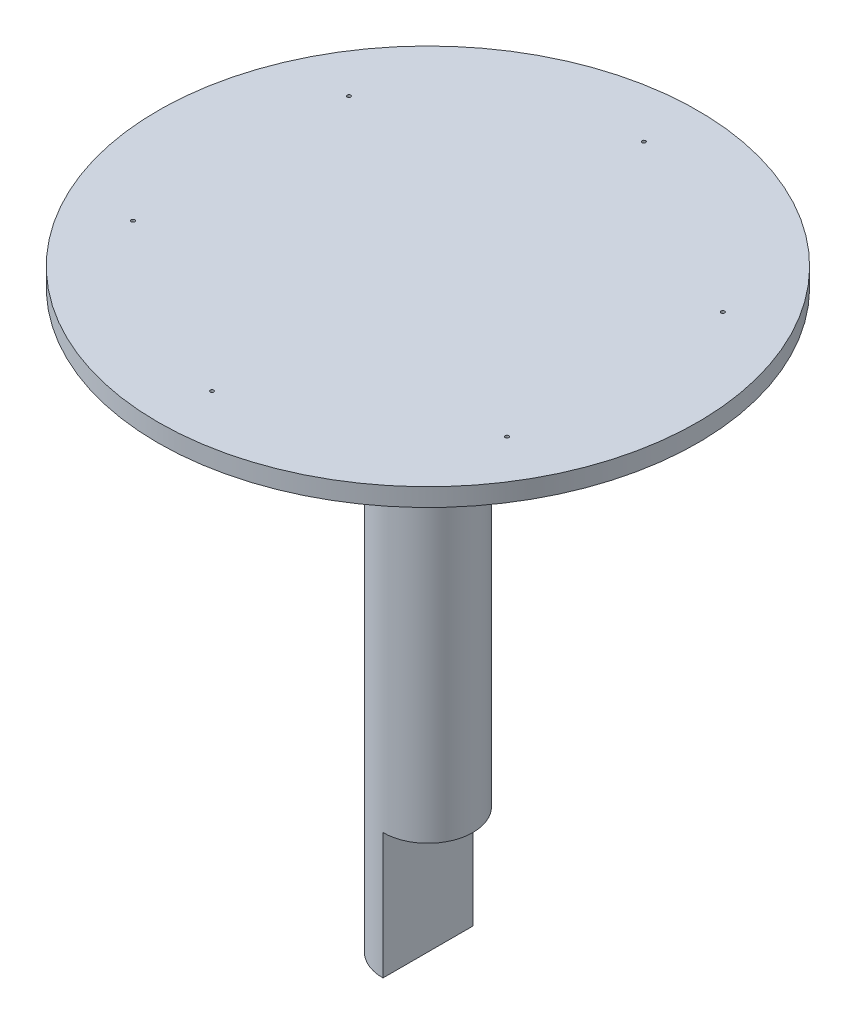
from build123d import *

# Parameters (mm, degrees)
BOSS_EXTRU_1_DEPTH      = 320
ENL_V_MAT_EXTRU_1_DEPTH = 70
ESQUISSE3_R             = 150
BOSS_EXTRU_2_DEPTH      = 10
ESQUISSE4_R             = 1
ENL_V_MAT_EXTRU_2_DEPTH = 10


with BuildPart() as part:
    # Esquisse1 → Boss.-Extru.1 (new body)
    with BuildSketch(Plane(origin=(0, 0, 0), x_dir=(1, 0, 0), z_dir=(0, 1, 0))):
        with BuildLine():
            ThreePointArc((56.049273334, -8.002390035), (31.049273334, 16.997609965), (6.049273334, -8.002390035))
            Line((6.049273334, -8.002390035), (56.049273334, -8.002390035))
        make_face()
        with BuildLine():
            Line((56.049273334, -8.002390035), (6.049273334, -8.002390035))
            ThreePointArc((6.049273334, -8.002390035), (31.049273334, -33.002390035), (56.049273334, -8.002390035))
        make_face()
    extrude(amount=BOSS_EXTRU_1_DEPTH)

    # Esquisse2 → Enlèv. mat.-Extru.1 (cut)
    with BuildSketch(Plane(origin=(0, 0, 0), x_dir=(-1, 0, 0), z_dir=(0, -1, 0))):
        with BuildLine():
            Line((-31.049273334, -33.002390035), (-31.049273334, 16.997609965))
            ThreePointArc((-31.049273334, 16.997609965), (-56.049273334, -8.002390035), (-31.049273334, -33.002390035))
        make_face()
    extrude(amount=-ENL_V_MAT_EXTRU_1_DEPTH, mode=Mode.SUBTRACT)

    # Esquisse3 → Boss.-Extru.2 (add)
    with BuildSketch(Plane(origin=(0, 320, 0), x_dir=(1, 0, 0), z_dir=(0, 1, 0))):
        with Locations(Location((31.049273334, -8.002390035, 0), (0, 0, 270))):
            Circle(ESQUISSE3_R)
    extrude(amount=BOSS_EXTRU_2_DEPTH)

    # Esquisse4 → Enlèv. mat.-Extru.2 (cut)
    with BuildSketch(Plane(origin=(0, 330, 0), x_dir=(1, 0, 0), z_dir=(0, 1, 0))):
        with Locations(Location((-72.87377512, -68.002390035, 0), (0, 0, 270))):
            Circle(ESQUISSE4_R)
        with Locations(Location((-72.87377512, 51.997609965, 0), (0, 0, 270))):
            Circle(ESQUISSE4_R)
        with Locations(Location((31.049273334, 111.997609965, 0), (0, 0, 270))):
            Circle(ESQUISSE4_R)
        with Locations(Location((134.972321788, 51.997609965, 0), (0, 0, 270))):
            Circle(ESQUISSE4_R)
        with Locations(Location((134.972321788, -68.002390035, 0), (0, 0, 270))):
            Circle(ESQUISSE4_R)
        with Locations(Location((31.049273334, -128.002390035, 0), (0, 0, 270))):
            Circle(ESQUISSE4_R)
    extrude(amount=-ENL_V_MAT_EXTRU_2_DEPTH, mode=Mode.SUBTRACT)


solid = part.part
